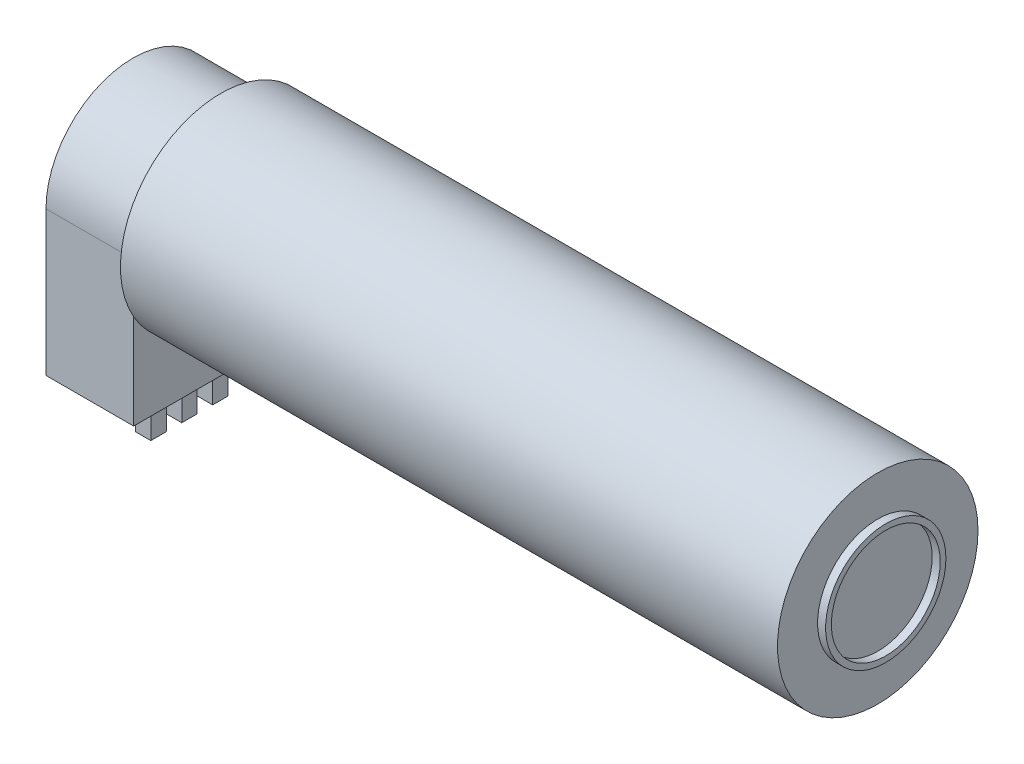
from build123d import *

# Parameters (mm, degrees)
SKETCH_2_R      = 17.5
EXTRUDE_1_DEPTH = 114.7
SKETCH_3_R      = 10.5
SKETCH_3_R_2    = 9.5
EXTRUDE_2_DEPTH = 1.4
EXTRUDE_6_DEPTH = 15.3
SKETCH_8_W      = 2.7
SKETCH_8_H      = 2.7
EXTRUDE_7_DEPTH = 8
SKETCH_8_3_W    = 0.7
SKETCH_8_3_H    = 0.7
EXTRUDE_8_DEPTH = 2


with BuildPart() as part:
    # 草图2 → 凸台-拉伸1 (new body)
    with BuildSketch(Plane(origin=(0, 0, 0), x_dir=(0, 0, -1), z_dir=(1, 0, 0))):
        Circle(SKETCH_2_R)
    extrude(amount=EXTRUDE_1_DEPTH)

    # 草图3 → 凸台-拉伸2 (add)
    with BuildSketch(Plane(origin=(114.7, 0, 0), x_dir=(0, 0, -1), z_dir=(1, 0, 0))):
        Circle(SKETCH_3_R)
        Circle(SKETCH_3_R_2, mode=Mode.SUBTRACT)
    extrude(amount=EXTRUDE_2_DEPTH)

    # 草图6 → 凸台-拉伸6 (add)
    with BuildSketch(Plane.ZY):
        with BuildLine():
            Line((-15.2, 0), (-15.2, -25.2))
            Line((-15.2, -25.2), (15.2, -25.2))
            Line((15.2, -25.2), (15.2, 0))
            ThreePointArc((15.2, 0), (0, 15.2), (-15.2, 0))
        make_face()
    extrude(amount=EXTRUDE_6_DEPTH)

    # 草图8 → 凸台-拉伸7 (add)
    with BuildSketch(Plane.XZ.offset(25.2)):
        with Locations((-5.65, -4.25)):
            Rectangle(SKETCH_8_W, SKETCH_8_H)
        with Locations((-5.65, 1.15)):
            Rectangle(SKETCH_8_W, SKETCH_8_H)
        with Locations((-5.65, 6.55)):
            Rectangle(SKETCH_8_W, SKETCH_8_H)
    extrude(amount=EXTRUDE_7_DEPTH)

    # 草图8<3> → 凸台-拉伸8 (add)
    with BuildSketch(Plane.XZ.offset(25.2)):
        with Locations((-5.65, -1.55)):
            Rectangle(SKETCH_8_3_W, SKETCH_8_3_H)
        with Locations((-5.65, 3.85)):
            Rectangle(SKETCH_8_3_W, SKETCH_8_3_H)
    extrude(amount=EXTRUDE_8_DEPTH)


solid = part.part
